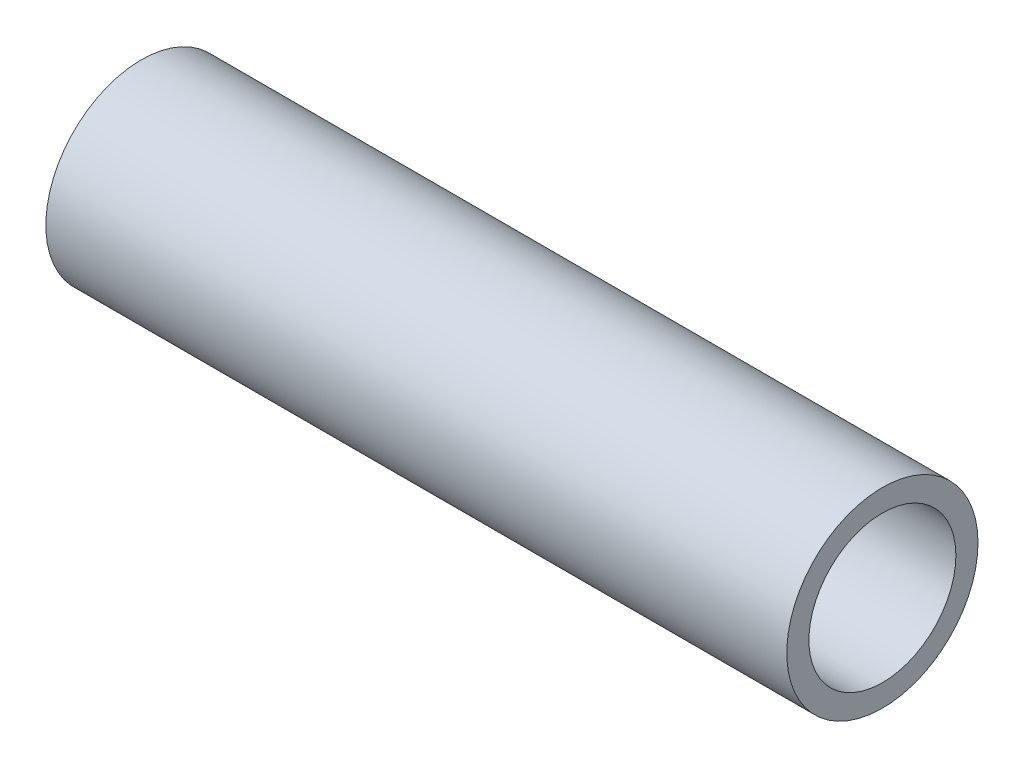
from build123d import *

# Parameters (mm, degrees)
SKETCH_1_R      = 8
SKETCH_1_R_2    = 6.15
EXTRUDE_1_DEPTH = 62


with BuildPart() as part:
    # ｽｹｯﾁ1 → ﾎﾞｽ - 押し出し1 (new body)
    with BuildSketch(Plane(origin=(0, 0, 0), x_dir=(0, 0, -1), z_dir=(1, 0, 0))):
        Circle(SKETCH_1_R)
        Circle(SKETCH_1_R_2, mode=Mode.SUBTRACT)
    extrude(amount=EXTRUDE_1_DEPTH)


solid = part.part
